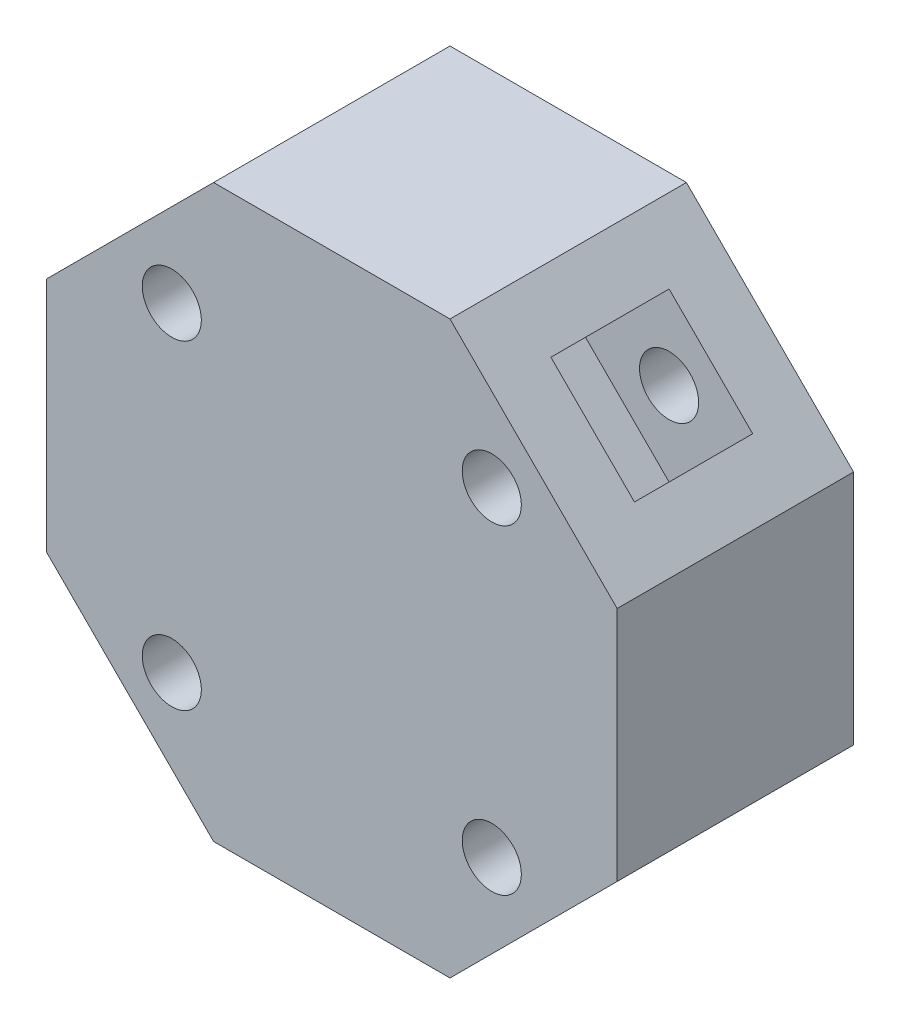
from build123d import *

# Parameters (mm, degrees)
BOSS_EXTRUDE1_DEPTH     = 25.4
SKETCH2_W               = 12.7
SKETCH2_H               = 12.7
CUT_EXTRUDE1_DEPTH      = 12.7
MIRROR2_COPY_1_SKETCH_W = 12.7
MIRROR2_COPY_1_SKETCH_H = 12.7
MIRROR2_COPY_1_DEPTH    = 12.7
SKETCH3_R               = 3.175
CUT_EXTRUDE2_DEPTH      = 51.252303648


with BuildPart() as part:
    # Sketch1 → Boss-Extrude1 (new body)
    with BuildSketch(Plane.XY):
        Polygon((-30.660512242, 12.7), (-30.660512242, -12.7), (-12.7, -30.660512242), (12.7, -30.660512242), (30.660512242, -12.7), (30.660512242, 12.7), (12.7, 30.660512242), (-12.7, 30.660512242), align=None)
    extrude(amount=BOSS_EXTRUDE1_DEPTH)

    # Sketch2 → Cut-Extrude1 (cut)
    with BuildSketch(Plane(origin=(21.680256121, 21.680256121, 0), x_dir=(0, 0, -1), z_dir=(0.7071067811865479, 0.7071067811865472, 0))):
        with Locations((-12.7, 0)):
            Rectangle(SKETCH2_W, SKETCH2_H)
    cut_extrude1 = extrude(amount=-CUT_EXTRUDE1_DEPTH, mode=Mode.SUBTRACT)

    # Mirror1: Cut-Extrude1 across plane
    add(cut_extrude1.mirror(Plane(origin=(0, 0, 0), x_dir=(0, 0, 1), z_dir=(1, 0, 0))), mode=Mode.SUBTRACT)

    # Mirror2: Cut-Extrude1 across plane
    add(cut_extrude1.mirror(Plane.ZX), mode=Mode.SUBTRACT)

    # Mirror2 copy 1 sketch → Mirror2 copy 1 (cut)
    with BuildSketch(Plane(origin=(-21.680256121, -21.680256121, 0), x_dir=(0, 0, -1), z_dir=(-0.7071067811865472, -0.7071067811865479, 0))):
        with Locations((-12.7, 0)):
            Rectangle(MIRROR2_COPY_1_SKETCH_W, MIRROR2_COPY_1_SKETCH_H)
    extrude(amount=-MIRROR2_COPY_1_DEPTH, mode=Mode.SUBTRACT)

    # Sketch3 → Cut-Extrude2 (cut, through all)
    with BuildSketch(Plane.XY.offset(25.4)):
        with Locations((-17.190128061, 17.190128061)):
            Circle(SKETCH3_R)
        with Locations(Location((-17.190128061, -17.190128061, 0), (0, 0, 180))):
            Circle(SKETCH3_R)
        with Locations((17.190128061, -17.190128061)):
            Circle(SKETCH3_R)
        with Locations(Location((17.190128061, 17.190128061, 0), (0, 0, 180))):
            Circle(SKETCH3_R)
    extrude(amount=-CUT_EXTRUDE2_DEPTH, mode=Mode.SUBTRACT)


solid = part.part
